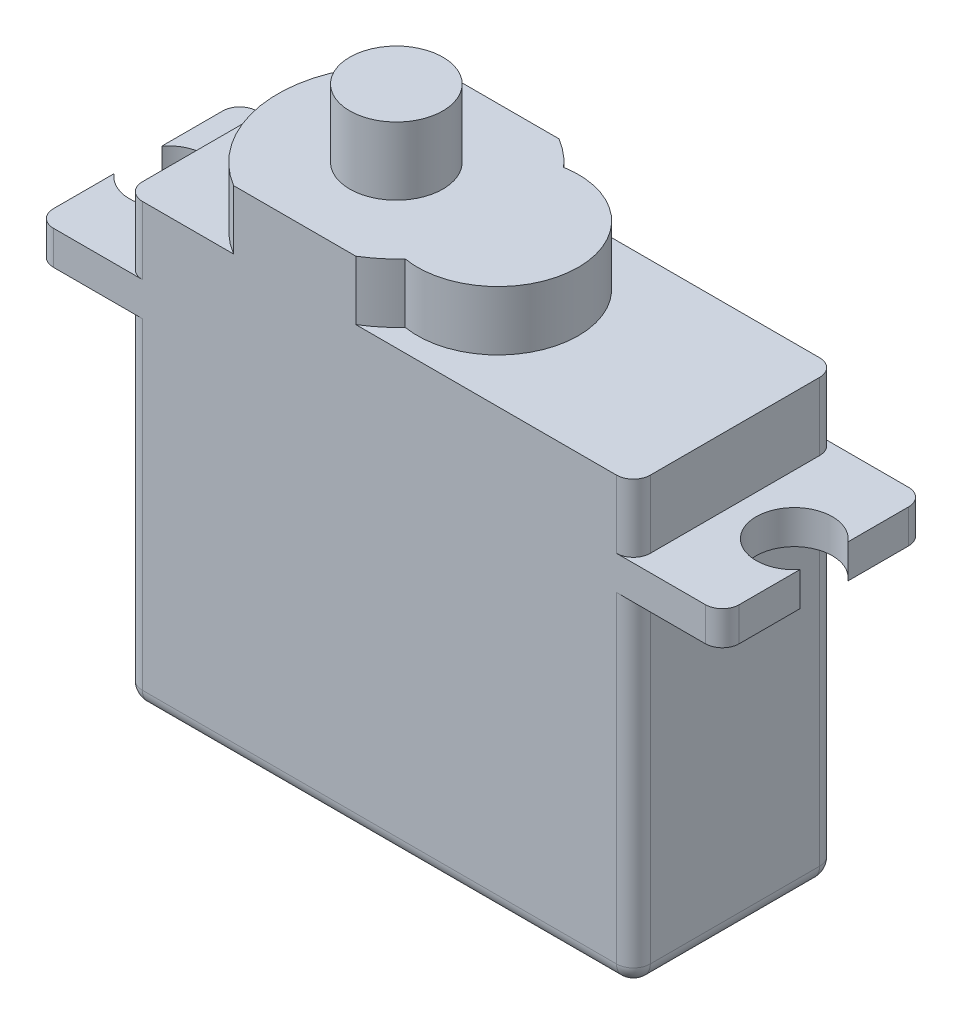
from build123d import *

# Parameters (mm, degrees)
SKETCH1_W           = 30
SKETCH1_H           = 12
BOSS_EXTRUDE1_DEPTH = 20
BOSS_EXTRUDE2_DEPTH = 2
SKETCH3_W           = 30
SKETCH3_H           = 12
BOSS_EXTRUDE3_DEPTH = 4
BOSS_EXTRUDE4_DEPTH = 3.5
SKETCH5_R           = 2.75
BOSS_EXTRUDE5_DEPTH = 4
FILLET1_R           = 1


with BuildPart() as part:
    # Sketch1 → Boss-Extrude1 (new body)
    with BuildSketch(Plane(origin=(0, 0, 0), x_dir=(1, 0, 0), z_dir=(0, 1, 0))):
        Rectangle(SKETCH1_W, SKETCH1_H)
    extrude(amount=BOSS_EXTRUDE1_DEPTH)

    # Sketch2 → Boss-Extrude2 (add)
    with BuildSketch(Plane(origin=(0, 20, 0), x_dir=(1, 0, 0), z_dir=(0, 1, 0))):
        with BuildLine():
            Line((-20.25, 6), (20.25, 6))
            Line((20.25, 6), (20.25, 1.414213562))
            ThreePointArc((20.25, 1.414213562), (16.25, 0), (20.25, -1.414213562))
            Line((20.25, -1.414213562), (20.25, -6))
            Line((20.25, -6), (-20.25, -6))
            Line((-20.25, -6), (-20.25, -1.414213562))
            ThreePointArc((-20.25, -1.414213562), (-16.25, 0), (-20.25, 1.414213562))
            Line((-20.25, 1.414213562), (-20.25, 6))
        make_face()
    extrude(amount=BOSS_EXTRUDE2_DEPTH)

    # Sketch3 → Boss-Extrude3 (add)
    with BuildSketch(Plane(origin=(0, 22, 0), x_dir=(1, 0, 0), z_dir=(0, 1, 0))):
        Rectangle(SKETCH3_W, SKETCH3_H)
    extrude(amount=BOSS_EXTRUDE3_DEPTH)

    # Sketch4 → Boss-Extrude4 (add)
    with BuildSketch(Plane(origin=(0, 26, 0), x_dir=(1, 0, 0), z_dir=(0, 1, 0))):
        with BuildLine():
            Line((-8.605551275, 6), (-1.394448725, 6))
            ThreePointArc((-1.394448725, 6), (-0.546683534, 5.400738139), (0.203125, 4.682679813))
            ThreePointArc((0.203125, 4.682679813), (5.75, 0), (0.203125, -4.682679813))
            ThreePointArc((0.203125, -4.682679813), (-0.546683534, -5.400738139), (-1.394448725, -6))
            Line((-1.394448725, -6), (-8.605551275, -6))
            ThreePointArc((-8.605551275, -6), (-12, 0), (-8.605551275, 6))
        make_face()
    extrude(amount=BOSS_EXTRUDE4_DEPTH)

    # Sketch5 → Boss-Extrude5 (add)
    with BuildSketch(Plane(origin=(0, 29.5, 0), x_dir=(1, 0, 0), z_dir=(0, 1, 0))):
        with Locations(Location((-5, 0, 0), (0, 0, 270))):
            Circle(SKETCH5_R)
    extrude(amount=BOSS_EXTRUDE5_DEPTH)

    # Fillet1
    fillet1_edges = [part.edges().sort_by_distance(p)[0] for p in [
        (20.25, 21, 6),
        (20.25, 21, -6),
        (-20.25, 21, -6),
        (-20.25, 21, 6),
        (15, 24, 6),
        (15, 24, -6),
        (-15, 24, -6),
        (-15, 24, 6),
        (0, 0, 6),
        (-15, 0, 0),
        (0, 0, -6),
        (15, 0, 0),
        (15, 10, 6),
        (-15, 10, 6),
        (-15, 10, -6),
        (15, 10, -6),
    ]]
    fillet(fillet1_edges, radius=FILLET1_R)


solid = part.part
